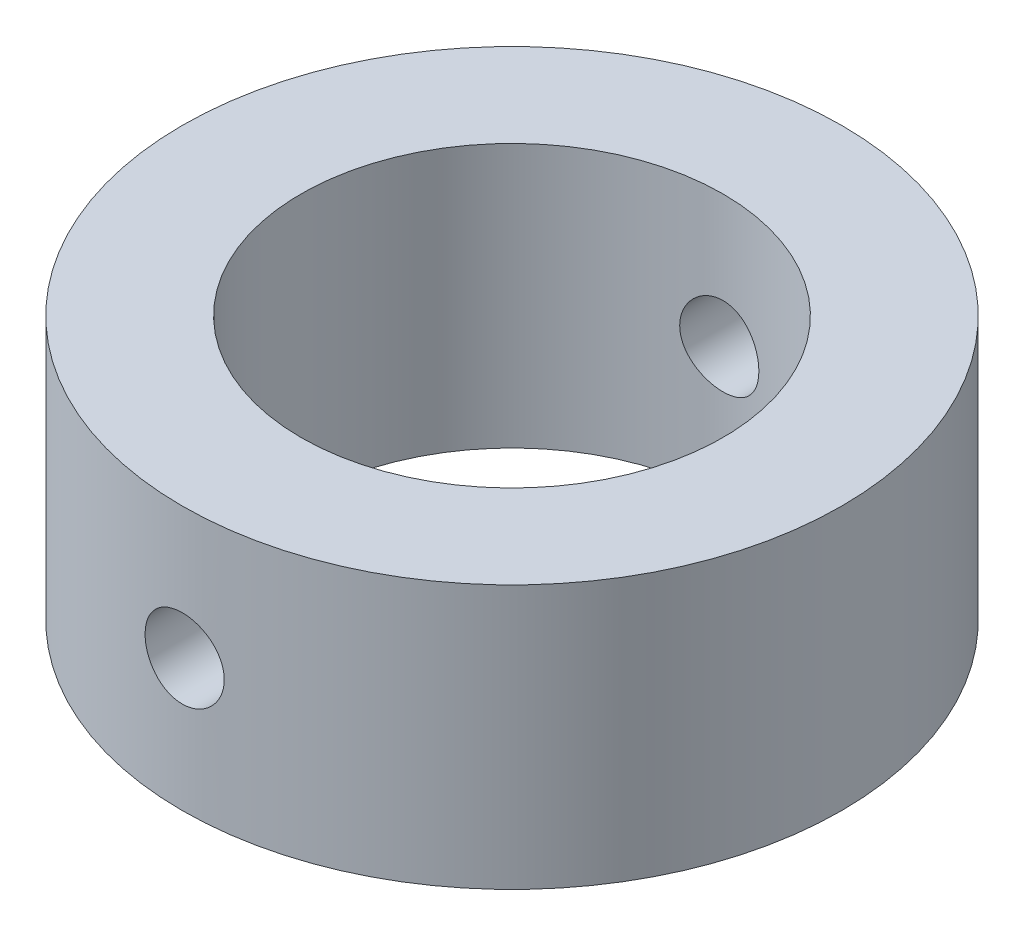
from build123d import *

# Parameters (mm, degrees)
SKETCH1_R           = 12.5
SKETCH1_R_2         = 8
BOSS_EXTRUDE1_DEPTH = 10
SKETCH2_R           = 1.5
CUT_EXTRUDE1_DEPTH  = 20


with BuildPart() as part:
    # Sketch1 → Boss-Extrude1 (new body)
    with BuildSketch(Plane(origin=(0, 0, 0), x_dir=(1, 0, 0), z_dir=(0, 1, 0))):
        with Locations(Location((0, 0, 0), (0, 0, 270))):
            Circle(SKETCH1_R)
        with Locations(Location((0, 0, 0), (0, 0, 270))):
            Circle(SKETCH1_R_2, mode=Mode.SUBTRACT)
    extrude(amount=BOSS_EXTRUDE1_DEPTH)

    # Sketch2 → Cut-Extrude1 (cut, symmetric)
    with BuildSketch(Plane.XY):
        with Locations((0, 5)):
            Circle(SKETCH2_R)
    extrude(amount=CUT_EXTRUDE1_DEPTH, both=True, mode=Mode.SUBTRACT)


solid = part.part
